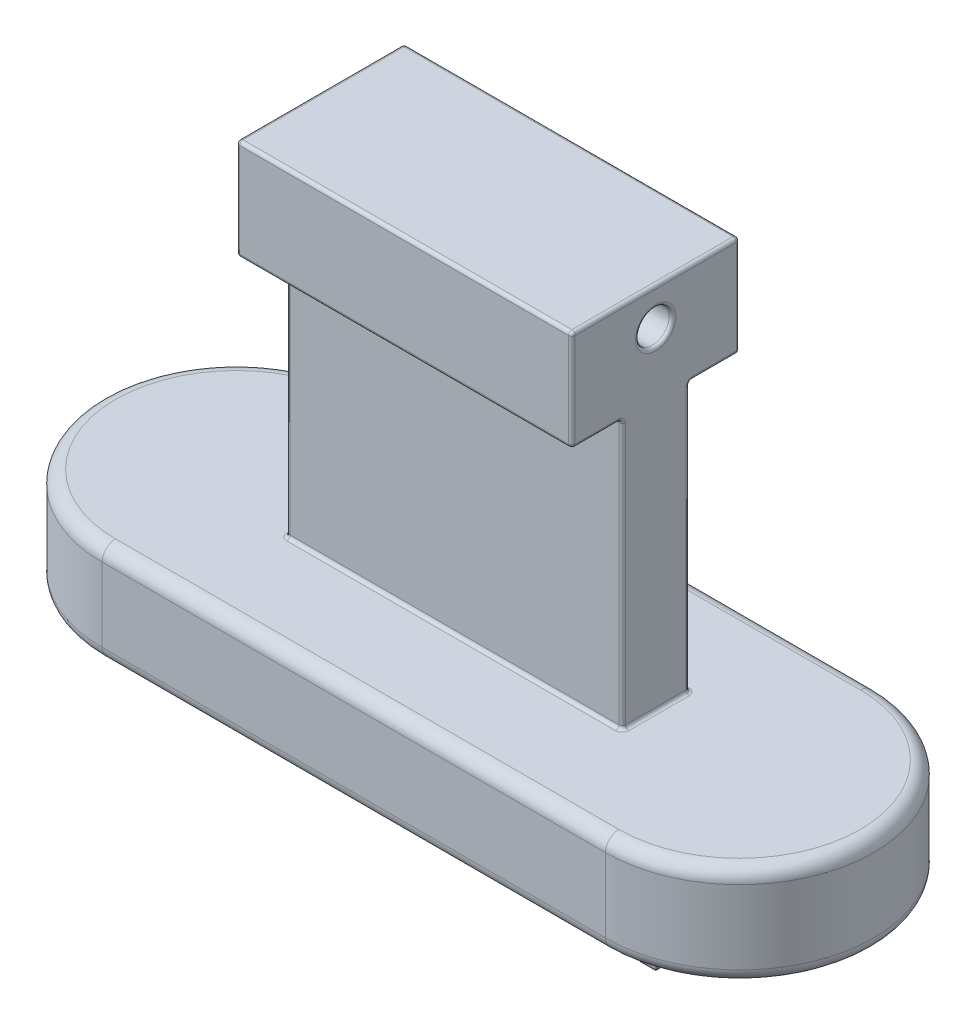
from build123d import *

# Parameters (mm, degrees)
BOSS_EXTRUDE1_DEPTH = 3
FILLET1_R           = 0.4
BOSS_EXTRUDE5_DEPTH = 0.5
FILLET5_R           = 0.1
SKETCH4_W           = 10
SKETCH4_H           = 1
BOSS_EXTRUDE6_DEPTH = 8
SKETCH6_W           = 10
SKETCH6_H           = 5
BOSS_EXTRUDE7_DEPTH = 3
FILLET6_R           = 0.1
SKETCH8_R           = 0.5
CUT_EXTRUDE1_DEPTH  = 50
FILLET7_R           = 0.1


with BuildPart() as part:
    # Sketch1 → Boss-Extrude1 (new body)
    with BuildSketch(Plane(origin=(0, 0, 0), x_dir=(1, 0, 0), z_dir=(0, 1, 0))):
        with BuildLine():
            Line((-7.5, 1.5), (7.5, 1.5))
            ThreePointArc((7.5, 1.5), (11.5, -2.5), (7.5, -6.5))
            Line((7.5, -6.5), (-7.5, -6.5))
            ThreePointArc((-7.5, -6.5), (-11.5, -2.5), (-7.5, 1.5))
        make_face()
    extrude(amount=BOSS_EXTRUDE1_DEPTH)

    # Fillet1
    fillet1_edges = [part.edges().sort_by_distance(p)[0] for p in [
        (11.5, 3, 2.5),
        (0, 3, -1.5),
        (-11.5, 3, 2.5),
        (0, 0, -1.5),
        (11.5, 0, 2.5),
        (0, 0, 6.5),
        (-11.5, 0, 2.5),
        (0, 3, 6.5),
    ]]
    fillet(fillet1_edges, radius=FILLET1_R)

    # Sketch3 → Boss-Extrude5 (add)
    with BuildSketch(Plane(origin=(0, 0, 0), x_dir=(-1, 0, 0), z_dir=(0, -1, 0))):
        Polygon((0.25, 0.75), (-0.25, 0.75), (-0.25, -0.75), (-0.25, -5.75), (0.25, -5.75), (0.25, -0.75), align=None)
        Polygon((2.25, 0.75), (1.75, 0.75), (1.75, -0.75), (1.75, -5.75), (2.25, -5.75), (2.25, -0.75), align=None)
        Polygon((4.25, 0.75), (3.75, 0.75), (3.75, -0.75), (3.75, -5.75), (4.25, -5.75), (4.25, -0.75), align=None)
        Polygon((6.25, 0.75), (5.75, 0.75), (5.75, -0.75), (5.75, -5.75), (6.25, -5.75), (6.25, -0.75), align=None)
        Polygon((8.25, 0.75), (7.75, 0.75), (7.75, -0.75), (7.75, -5.75), (8.25, -5.75), (8.25, -0.75), align=None)
        Polygon((-1.75, 0.75), (-2.25, 0.75), (-2.25, -0.75), (-2.25, -5.75), (-1.75, -5.75), (-1.75, -0.75), align=None)
        Polygon((-3.75, 0.75), (-4.25, 0.75), (-4.25, -0.75), (-4.25, -5.75), (-3.75, -5.75), (-3.75, -0.75), align=None)
        Polygon((-5.75, 0.75), (-6.25, 0.75), (-6.25, -0.75), (-6.25, -5.75), (-5.75, -5.75), (-5.75, -0.75), align=None)
        Polygon((-7.75, 0.75), (-8.25, 0.75), (-8.25, -0.75), (-8.25, -5.75), (-7.75, -5.75), (-7.75, -0.75), align=None)
    extrude(amount=BOSS_EXTRUDE5_DEPTH)

    # Fillet5
    fillet5_edges = [part.edges().sort_by_distance(p)[0] for p in [
        (2.25, -0.5, 2.5),
        (2, -0.5, 5.75),
        (1.75, -0.5, 2.5),
        (2, -0.5, -0.75),
        (4.25, -0.5, 2.5),
        (4, -0.5, 5.75),
        (3.75, -0.5, 2.5),
        (4, -0.5, -0.75),
        (6.25, -0.5, 2.5),
        (6, -0.5, 5.75),
        (5.75, -0.5, 2.5),
        (6, -0.5, -0.75),
        (8.25, -0.5, 2.5),
        (8, -0.5, 5.75),
        (7.75, -0.5, 2.5),
        (8, -0.5, -0.75),
        (-1.75, -0.5, 2.5),
        (-2, -0.5, 5.75),
        (-2.25, -0.5, 2.5),
        (-2, -0.5, -0.75),
        (0.25, -0.5, 2.5),
        (0, -0.5, 5.75),
        (-0.25, -0.5, 2.5),
        (0, -0.5, -0.75),
        (-3.75, -0.5, 2.5),
        (-4, -0.5, 5.75),
        (-4.25, -0.5, 2.5),
        (-4, -0.5, -0.75),
        (-5.75, -0.5, 2.5),
        (-6, -0.5, 5.75),
        (-6.25, -0.5, 2.5),
        (-6, -0.5, -0.75),
        (-7.75, -0.5, 2.5),
        (-8, -0.5, 5.75),
        (-8.25, -0.5, 2.5),
        (-8, -0.5, -0.75),
    ]]
    fillet(fillet5_edges, radius=FILLET5_R)

    # Sketch4 → Boss-Extrude6 (add)
    with BuildSketch(Plane(origin=(0, 3, 0), x_dir=(1, 0, 0), z_dir=(0, 1, 0))):
        with Locations((0, -2)):
            Rectangle(SKETCH4_W, SKETCH4_H)
        with Locations((0, -3)):
            Rectangle(SKETCH4_W, SKETCH4_H)
    extrude(amount=BOSS_EXTRUDE6_DEPTH)

    # Sketch6 → Boss-Extrude7 (add)
    with BuildSketch(Plane(origin=(0, 11, 0), x_dir=(1, 0, 0), z_dir=(0, 1, 0))):
        with Locations((0, -2.5)):
            Rectangle(SKETCH6_W, SKETCH6_H)
    extrude(amount=BOSS_EXTRUDE7_DEPTH)

    # Fillet6
    fillet6_edges = [part.edges().sort_by_distance(p)[0] for p in [
        (-5, 7, 1.5),
        (0, 3, 3.5),
        (-5, 7, 3.5),
        (5, 3, 2.5),
        (5, 7, 3.5),
        (0, 11, 1.5),
        (5, 7, 1.5),
        (0, 11, 3.5),
        (-5, 3, 2.5),
        (0, 3, 1.5),
        (-5, 11, 4.25),
        (0, 11, 5),
        (-5, 12.5, 5),
        (5, 11, 4.25),
        (5, 11, 0.75),
        (5, 12.5, 5),
        (0, 14, 0),
        (5, 12.5, 0),
        (-5, 14, 2.5),
        (-5, 12.5, 0),
        (0, 14, 5),
        (5, 14, 2.5),
        (-5, 11, 0.75),
        (0, 11, 0),
    ]]
    fillet(fillet6_edges, radius=FILLET6_R)

    # Sketch8 → Cut-Extrude1 (cut)
    with BuildSketch(Plane.ZY.offset(5)):
        with Locations((2.5, 12.9)):
            Circle(SKETCH8_R)
    extrude(amount=-CUT_EXTRUDE1_DEPTH, mode=Mode.SUBTRACT)

    # Fillet7
    fillet7_edges = [part.edges().sort_by_distance(p)[0] for p in [
        (5, 12.9, 2),
        (-5, 12.9, 2),
    ]]
    fillet(fillet7_edges, radius=FILLET7_R)


solid = part.part
